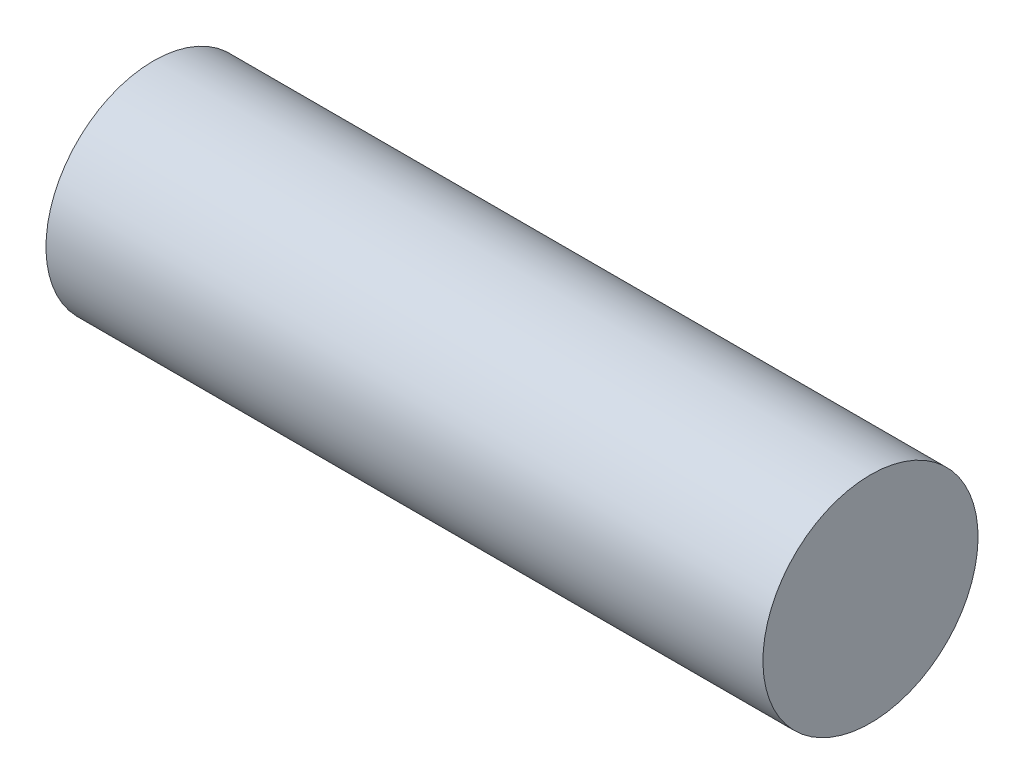
from build123d import *

# Parameters (mm, degrees)
SKETCH1_W = 100
SKETCH1_H = 15


with BuildPart() as part:
    # Sketch1 → Revolve1 (revolve)
    with BuildSketch(Plane.XY):
        with Locations((29.265777919, 7.915875015)):
            Rectangle(SKETCH1_W, SKETCH1_H)
    revolve(axis=Axis((79.265777919, 0.415875015, 0), (-1, 0, 0)))


solid = part.part
